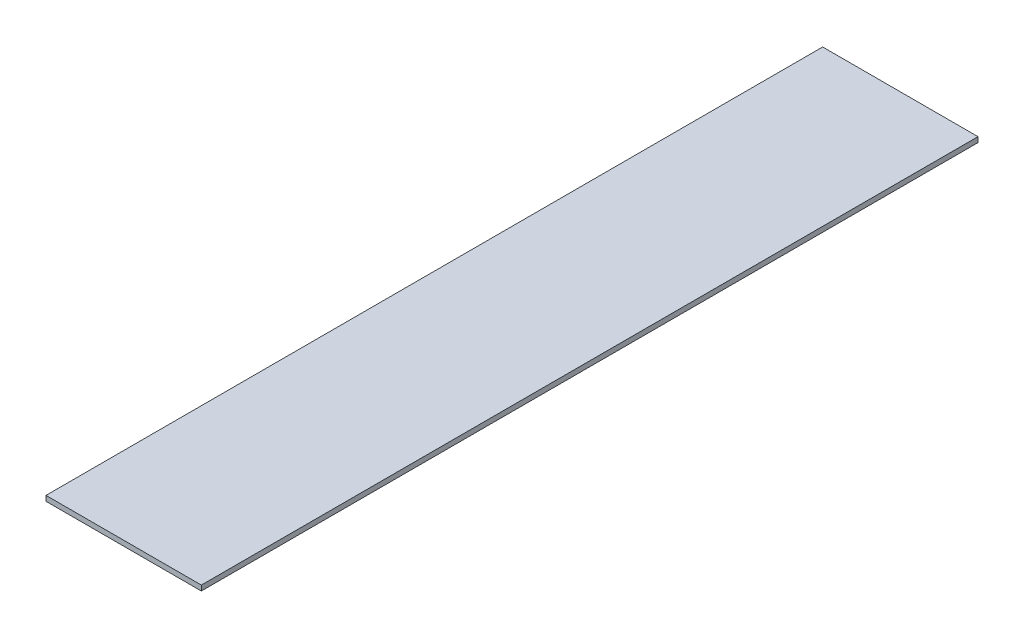
from build123d import *

# Parameters (mm, degrees)
SKETCH1_W           = 38.1
SKETCH1_H           = 190.5
BOSS_EXTRUDE1_DEPTH = 1.27


with BuildPart() as part:
    # Sketch1 → Boss-Extrude1 (new body)
    with BuildSketch(Plane(origin=(0, 0, 0), x_dir=(1, 0, 0), z_dir=(0, 1, 0))):
        with Locations((19.05, -95.25)):
            Rectangle(SKETCH1_W, SKETCH1_H)
    extrude(amount=BOSS_EXTRUDE1_DEPTH)


solid = part.part
